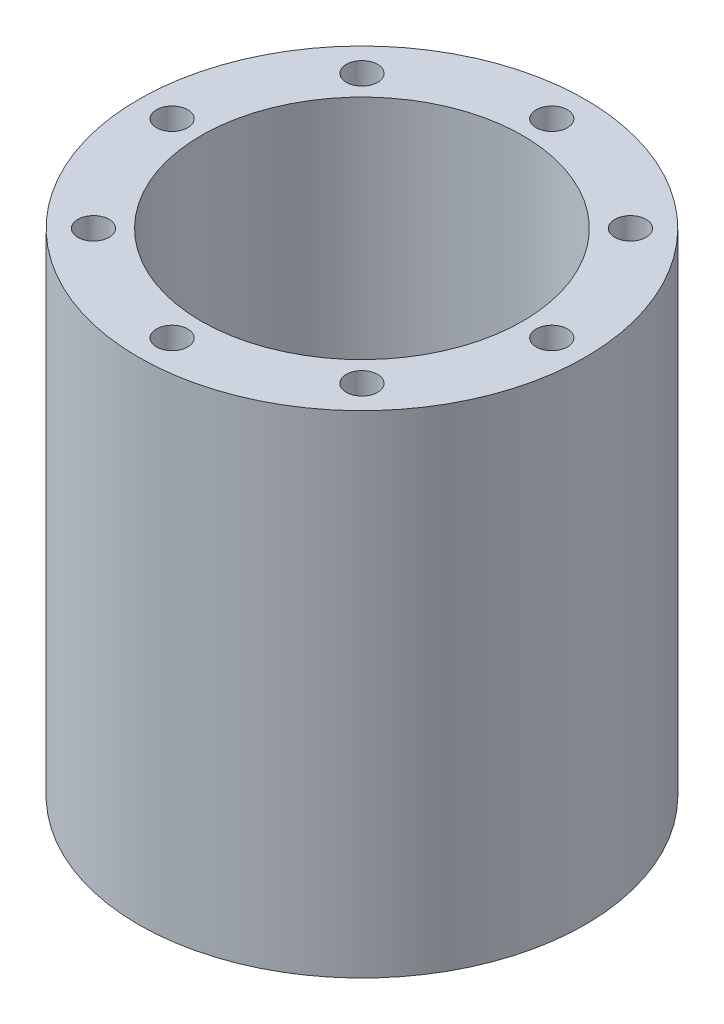
from build123d import *

# Parameters (mm, degrees)
SKETCH1_R           = 25
SKETCH1_R_2         = 18
SKETCH1_R_3         = 1.75
BOSS_EXTRUDE1_DEPTH = 27.5


with BuildPart() as part:
    # Sketch1 → Boss-Extrude1 (new, symmetric)
    with BuildSketch(Plane(origin=(0, 0, 0), x_dir=(1, 0, 0), z_dir=(0, 1, 0))):
        with Locations(Location((0, 0, 0), (0, 0, 270))):
            Circle(SKETCH1_R)
        with Locations(Location((0, 0, 0), (0, 0, 270))):
            Circle(SKETCH1_R_2, mode=Mode.SUBTRACT)
        with Locations(Location((0, 21.25, 0), (0, 0, 270))):
            Circle(SKETCH1_R_3, mode=Mode.SUBTRACT)
        with Locations(Location((15.0260191, 15.0260191, 0), (0, 0, 270))):
            Circle(SKETCH1_R_3, mode=Mode.SUBTRACT)
        with Locations(Location((21.25, 0, 0), (0, 0, 270))):
            Circle(SKETCH1_R_3, mode=Mode.SUBTRACT)
        with Locations(Location((15.0260191, -15.0260191, 0), (0, 0, 270))):
            Circle(SKETCH1_R_3, mode=Mode.SUBTRACT)
        with Locations(Location((0, -21.25, 0), (0, 0, 270))):
            Circle(SKETCH1_R_3, mode=Mode.SUBTRACT)
        with Locations(Location((-15.0260191, -15.0260191, 0), (0, 0, 270))):
            Circle(SKETCH1_R_3, mode=Mode.SUBTRACT)
        with Locations(Location((-21.25, 0, 0), (0, 0, 270))):
            Circle(SKETCH1_R_3, mode=Mode.SUBTRACT)
        with Locations(Location((-15.0260191, 15.0260191, 0), (0, 0, 270))):
            Circle(SKETCH1_R_3, mode=Mode.SUBTRACT)
    extrude(amount=BOSS_EXTRUDE1_DEPTH, both=True)


solid = part.part
